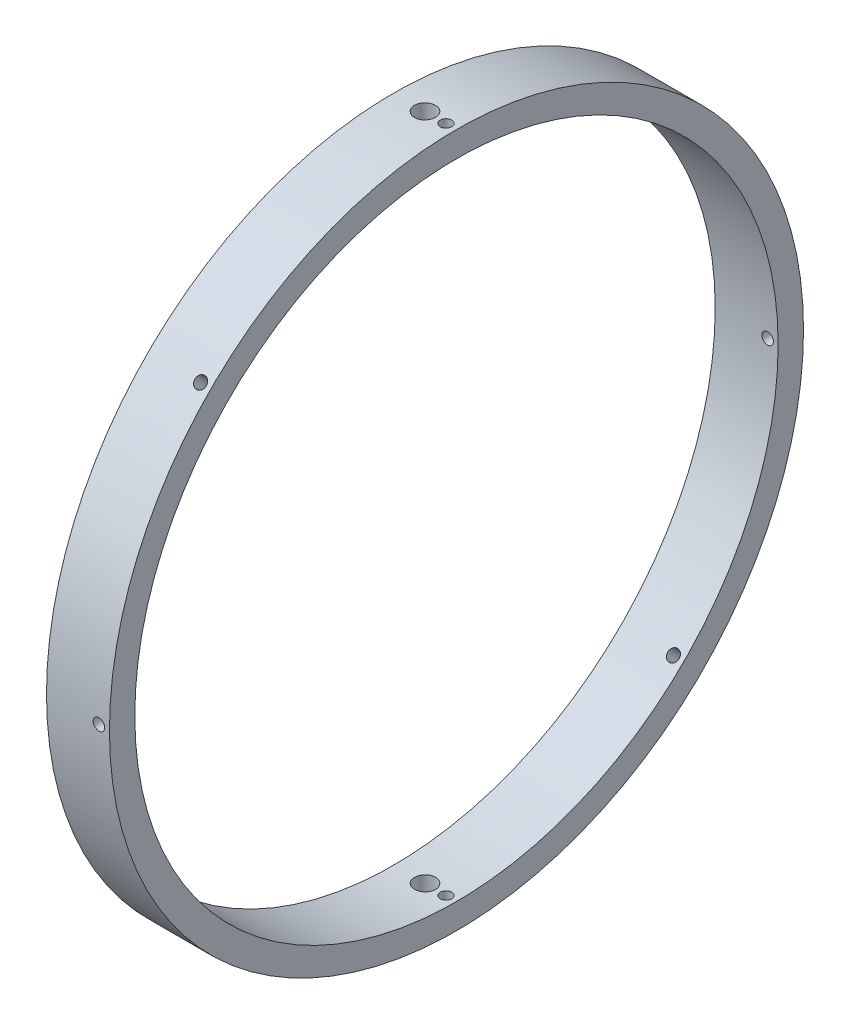
from build123d import *

# Parameters (mm, degrees)
MOUNT_SKETCH_W       = 18
MOUNT_SKETCH_H       = 7.25
PIN_HOLE_SKETCH_W    = 3
PIN_HOLE_SKETCH_H    = 9.25
PIN_HOLES_X2_COUNT   = 2
SCREW_HOLE_SKETCH_W  = 1.65
SCREW_HOLE_SKETCH_H  = 9.25
SCREW_HOLES_X8_COUNT = 8


with BuildPart() as part:
    # Mount Sketch → Mount (revolve)
    with BuildSketch(Plane.XY, mode=Mode.PRIVATE) as mount_sk:
        with Locations((-48, 95.625)):
            Rectangle(MOUNT_SKETCH_W, MOUNT_SKETCH_H)
    revolve(mount_sk.sketch.rotate(Axis((-108, 0, 0), (1, 0, 0)), 90), axis=Axis((-108, 0, 0), (1, 0, 0)))

    # Pin Hole Sketch → Pin Hole (revolve, cut)
    with BuildSketch(Plane.XY, mode=Mode.PRIVATE) as pin_hole_sk:
        with Locations((-46.5, 95.625)):
            Rectangle(PIN_HOLE_SKETCH_W, PIN_HOLE_SKETCH_H)
    pin_hole = revolve(pin_hole_sk.sketch.rotate(Axis((-48, 82, 0), (0, 1, 0)), 90), axis=Axis((-48, 82, 0), (0, 1, 0)), mode=Mode.SUBTRACT)

    # Pin Holes x2: Pin Hole ×2 about axis
    pin_holes_x2_axis = Axis((-38.1, 0, 0), (-1, 0, 0))
    for i in range(1, PIN_HOLES_X2_COUNT):
        add(pin_hole.rotate(pin_holes_x2_axis, i * 360 / PIN_HOLES_X2_COUNT), mode=Mode.SUBTRACT)

    # Screw Hole Sketch → Screw Hole (revolve, cut)
    with BuildSketch(Plane.XY, mode=Mode.PRIVATE) as screw_hole_sk:
        with Locations((-41.175, 95.625)):
            Rectangle(SCREW_HOLE_SKETCH_W, SCREW_HOLE_SKETCH_H)
    screw_hole = revolve(screw_hole_sk.sketch.rotate(Axis((-42, 82, 0), (0, 1, 0)), 90), axis=Axis((-42, 82, 0), (0, 1, 0)), mode=Mode.SUBTRACT)

    # Screw Holes x8: Screw Hole ×8 about axis
    screw_holes_x8_axis = Axis((-38.1, 0, 0), (-1, 0, 0))
    for i in range(1, SCREW_HOLES_X8_COUNT):
        add(screw_hole.rotate(screw_holes_x8_axis, i * 360 / SCREW_HOLES_X8_COUNT), mode=Mode.SUBTRACT)


solid = part.part
